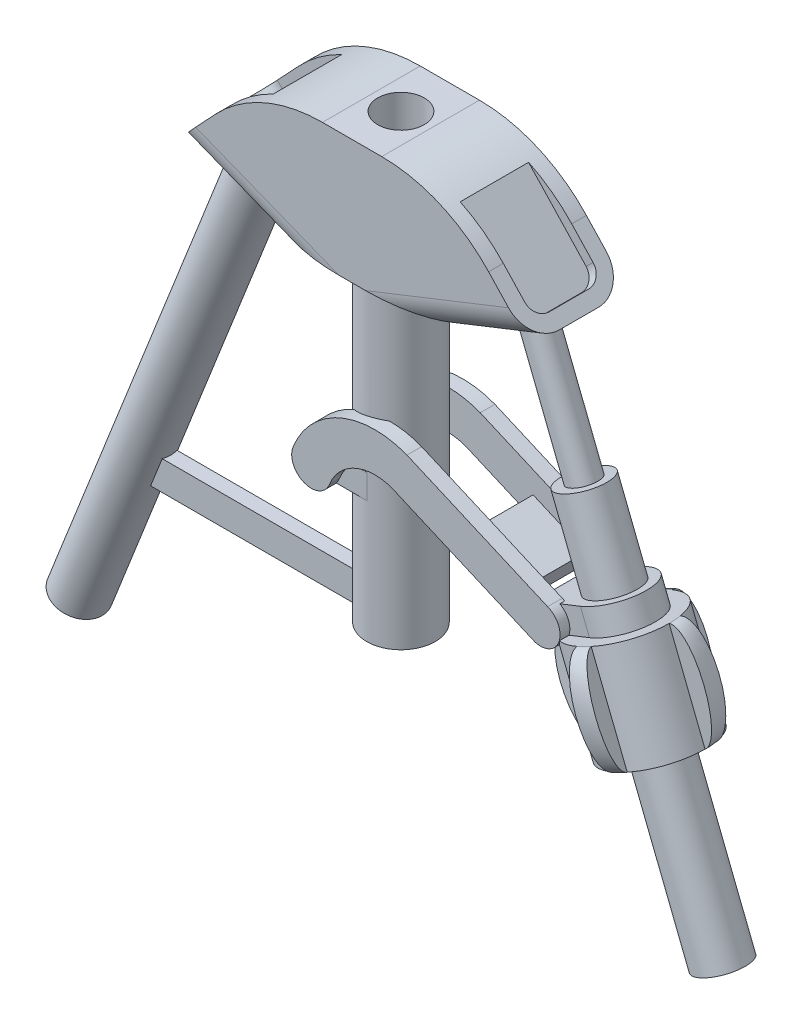
from build123d import *

# Parameters (mm, degrees)
BOSS_EXTRUDE2_DEPTH       = 20
FILLET1_R                 = 30
FILLET2_R                 = 6
SKETCH2_R                 = 7
BOSS_EXTRUDE3_DEPTH       = 65.089952611
SKETCH3_R                 = 4.7625
CUT_EXTRUDE1_DEPTH        = 109.008396677
BOSS_EXTRUDE5_DEPTH       = 26.439795129
BOSS_EXTRUDE5_DEPTH_BACK  = 2
SKETCH6_R                 = 3
SKETCH8_R                 = 5
BOSS_EXTRUDE6_DEPTH       = 77
SKETCH9_R                 = 5
BOSS_EXTRUDE7_DEPTH       = 103.4
BOSS_EXTRUDE8_DEPTH       = 5
BOSS_EXTRUDE9_DEPTH       = 5
CUT_EXTRUDE2_DEPTH        = 2
BOSS_EXTRUDE14_START      = -1
BOSS_EXTRUDE14_DEPTH      = 3
BOSS_EXTRUDE15_DEPTH      = 15
SKETCH23_R                = 10
BOSS_EXTRUDE17_DEPTH      = 20
REVOLVE1_ANGLE            = 15
CIRPATTERN1_COUNT         = 4
CIRPATTERN1_ANGLE         = 273
SKETCH24_R                = 3.175
CUT_EXTRUDE3_DEPTH        = 25.4
SKETCH25_R                = 3.175
CUT_EXTRUDE4_DEPTH        = 25.4
BOSS_EXTRUDE20_DEPTH      = 1.5
BOSS_EXTRUDE20_DEPTH_BACK = 1.5
SKETCH26_W                = 46.97935404
SKETCH26_H                = 6


with BuildPart() as part:
    # Sketch1 → Boss-Extrude2 (new body)
    with BuildSketch(Plane.XY):
        Polygon((0, -8.361996352), (38.1, -8.361996352), (55.47415821, -26.885626298), (38.1, -33.761996352), (0, -33.761996352), (-17.37415821, -26.885626298), align=None)
    extrude(amount=BOSS_EXTRUDE2_DEPTH)

    # Fillet1
    fillet1_edges = [part.edges().sort_by_distance(p)[0] for p in [
        (0, -8.361996352, 10),
        (38.1, -8.361996352, 10),
    ]]
    fillet(fillet1_edges, radius=FILLET1_R)

    # Fillet2
    fillet2_edges = [part.edges().sort_by_distance(p)[0] for p in [
        (46.787079105, -30.323811325, 20),
        (-8.687079105, -30.323811325, 20),
        (46.787079105, -30.323811325, 0),
        (-8.687079105, -30.323811325, 0),
    ]]
    fillet(fillet2_edges, radius=FILLET2_R)

    # Sketch2 → Boss-Extrude3 (add)
    with BuildSketch(Plane.XZ.offset(33.761996352)):
        with Locations(Location((19.05, 10, 0), (0, 0, 180))):
            Circle(SKETCH2_R)
    extrude(amount=BOSS_EXTRUDE3_DEPTH)

    # Sketch3 → Cut-Extrude1 (cut, through all)
    with BuildSketch(Plane.XZ.offset(98.851948963)):
        with Locations((19.05, 10)):
            Circle(SKETCH3_R)
    extrude(amount=-CUT_EXTRUDE1_DEPTH, mode=Mode.SUBTRACT)

    # Sketch6 → Boss-Extrude5 (add, two sides: drawn at the far end of the back side and taken through both)
    with BuildSketch(Plane(origin=(16.71256452, -42.226747224, 0), x_dir=(-0.9298231117187001, -0.36800676748363437, 0), z_dir=(0.36800676748363437, -0.9298231117187001, 0)).offset(-BOSS_EXTRUDE5_DEPTH_BACK)):
        with Locations(Location((-32.344339698, -10, 0), (0, 0, 180))):
            Circle(SKETCH6_R)
    extrude(amount=BOSS_EXTRUDE5_DEPTH + BOSS_EXTRUDE5_DEPTH_BACK)

    # Sketch8 → Boss-Extrude6 (add)
    with BuildSketch(Plane(origin=(26.442588059, -66.811079804, 0), x_dir=(0.9298231117187001, 0.36800676748363437, 0), z_dir=(0.36800676748363437, -0.9298231117187001, 0))):
        with Locations((32.344339698, 10)):
            Circle(SKETCH8_R)
    extrude(amount=BOSS_EXTRUDE6_DEPTH)

    # Sketch9 → Boss-Extrude7 (add)
    with BuildSketch(Plane(origin=(-11.552720348, -29.189643592, 0), x_dir=(-0.9298231117187001, 0.36800676748363437, 0), z_dir=(-0.36800676748363437, -0.9298231117187001, 0))):
        with Locations(Location((-3.081920858, -10, 0), (0, 0, 53.130102354))):
            Circle(SKETCH9_R)
    extrude(amount=BOSS_EXTRUDE7_DEPTH)

    # Sketch11 → Boss-Extrude8 (add)
    with BuildSketch(Plane(origin=(32.698703106, -82.618072703, 0), x_dir=(-0.9298231117187001, -0.36800676748363437, 0), z_dir=(0.36800676748363437, -0.9298231117187001, 0))):
        with BuildLine():
            Line((-32.344339698, -3), (-22.259943936, -3))
            Line((-22.259943936, -3), (-22.259943936, -17))
            Line((-22.259943936, -17), (-32.344339698, -17))
            ThreePointArc((-32.344339698, -17), (-39.344339698, -10), (-32.344339698, -3))
        make_face()
    extrude(amount=BOSS_EXTRUDE8_DEPTH)

    # Sketch15 → Boss-Extrude9 (add)
    with BuildSketch(Plane(origin=(0, -68.851948963, 0), x_dir=(-1, 0, 0), z_dir=(0, -1, 0))):
        with BuildLine():
            Line((-19.05, -3), (-7.185808352, -3))
            Line((-7.185808352, -3), (-7.185808352, -17))
            Line((-7.185808352, -17), (-19.05, -17))
            ThreePointArc((-19.05, -17), (-26.05, -10), (-19.05, -3))
        make_face()
    extrude(amount=BOSS_EXTRUDE9_DEPTH)

    # Sketch17 → Cut-Extrude2 (cut)
    with BuildSketch(Plane(origin=(16.096305264, 15.097459572, 0), x_dir=(0, 0, -1), z_dir=(0.7293749969664987, 0.6841141087568068, 0))):
        with BuildLine():
            Line((-17, -51.560357903), (-17, -29.560357903))
            Line((-17, -29.560357903), (-3, -29.560357903))
            Line((-3, -29.560357903), (-3, -51.560357903))
            ThreePointArc((-3, -51.560357903), (-3.878679656, -53.681678246), (-6, -54.560357903))
            Line((-6, -54.560357903), (-14, -54.560357903))
            ThreePointArc((-14, -54.560357903), (-16.121320344, -53.681678246), (-17, -51.560357903))
        make_face()
    cut_extrude2 = extrude(amount=-CUT_EXTRUDE2_DEPTH, mode=Mode.SUBTRACT)

    # Mirror2: Cut-Extrude2 across plane
    add(cut_extrude2.mirror(Plane(origin=(19.05, -8.361996352, 20), x_dir=(0, 0, 1), z_dir=(-1, 0, 0))), mode=Mode.SUBTRACT)

    # Sketch19 → Boss-Extrude14 (add)
    with BuildSketch(Plane.XY.offset(17).offset(BOSS_EXTRUDE14_START)):
        with BuildLine():
            Line((58.057147373, -72.145843092), (29.272181754, -59.674022052))
            ThreePointArc((29.272181754, -59.674022052), (15.498497411, -59.957615802), (5.959562875, -69.897612467))
            ThreePointArc((5.959562875, -69.897612467), (8.231471856, -75.078194441), (13.412053829, -72.806285459))
            ThreePointArc((13.412053829, -72.806285459), (18.711461905, -67.28406509), (26.363508762, -67.126513006))
            Line((26.363508762, -67.126513006), (55.459651192, -79.705751724))
            ThreePointArc((55.459651192, -79.705751724), (60.391206803, -77.17398758), (58.057147373, -72.145843092))
        make_face()
    boss_extrude14 = extrude(amount=BOSS_EXTRUDE14_DEPTH)

    # Mirror4: Boss-Extrude14 across plane
    add(boss_extrude14.mirror(Plane.XY.offset(10)))

    # Sketch20 → Boss-Extrude15 (add)
    with BuildSketch(Plane.XY.offset(19)):
        Polygon((49.419158693, -77.094244123), (38.542872969, -72.392060841), (40.089263446, -68.815215009), (50.96554917, -73.51739829), align=None)
    extrude(amount=-BOSS_EXTRUDE15_DEPTH)

    # Sketch23 → Boss-Extrude17 (add)
    with BuildSketch(Plane(origin=(34.538736943, -87.267188261, 0), x_dir=(0.9298231117187001, 0.36800676748363437, 0), z_dir=(0.36800676748363437, -0.9298231117187001, 0))):
        with Locations(Location((32.344339698, 10, 0), (0, 0, 143.130102354))):
            Circle(SKETCH23_R)
    extrude(amount=BOSS_EXTRUDE17_DEPTH)

    # Sketch22 → Revolve1 (revolve)
    with BuildSketch(Plane.XY.offset(10)):
        with BuildLine():
            Line((64.613251528, -75.364252363), (73.911482645, -71.684184688))
            add(Edge.make_bspline(
                [(81.271617995, -90.280646922), (84.545728308, -87.915536418), (81.065760473, -79.122886915), (77.585792638, -70.330237413), (73.911482645, -71.684184688)],
                knots=[3.25665709, 3.25665709, 3.25665709, 4.769921199, 4.769921199, 6.283185307, 6.283185307, 6.283185307], degree=2, weights=[1, 0.727152145, 1, 0.727152145, 1]))
            Line((81.271617995, -90.280646922), (71.973386878, -93.960714597))
            Line((71.973386878, -93.960714597), (64.613251528, -75.364252363))
        make_face()
    revolve1 = revolve(axis=Axis((82.112490758, -119.578648703, 10), (-0.3680067674836343, 0.9298231117187002, 0)), revolution_arc=REVOLVE1_ANGLE)

    # CirPattern1: Revolve1 ×4 about axis
    cirpattern1_axis = Axis((82.112490758, -119.578648703, 10), (-0.3680067674836343, 0.9298231117187002, 0))
    for i in range(1, CIRPATTERN1_COUNT):
        add(revolve1.rotate(cirpattern1_axis, i * CIRPATTERN1_ANGLE / (CIRPATTERN1_COUNT - 1)))

    # Sketch24 → Cut-Extrude3 (cut)
    with BuildSketch(Plane(origin=(-49.604620105, -125.333353344, 0), x_dir=(0.9298231117187001, -0.36800676748363437, 0), z_dir=(-0.36800676748363437, -0.9298231117187001, 0))):
        with Locations((3.081920858, 10)):
            Circle(SKETCH24_R)
    extrude(amount=-CUT_EXTRUDE3_DEPTH, mode=Mode.SUBTRACT)

    # Sketch25 → Cut-Extrude4 (cut)
    with BuildSketch(Plane(origin=(54.779109155, -138.407459406, 0), x_dir=(0.9298231117187001, 0.36800676748363437, 0), z_dir=(0.36800676748363437, -0.9298231117187001, 0))):
        with Locations((32.344339698, 10)):
            Circle(SKETCH25_R)
    extrude(amount=-CUT_EXTRUDE4_DEPTH, mode=Mode.SUBTRACT)

    # Sketch26 → Boss-Extrude20 (add, two sides: drawn at the far end of the back side and taken through both)
    with BuildSketch(Plane.XY.offset(10).offset(-BOSS_EXTRUDE20_DEPTH_BACK)):
        with Locations((-10.248504991, -95.851948963)):
            Rectangle(SKETCH26_W, SKETCH26_H)
    extrude(amount=BOSS_EXTRUDE20_DEPTH + BOSS_EXTRUDE20_DEPTH_BACK)


solid = part.part
